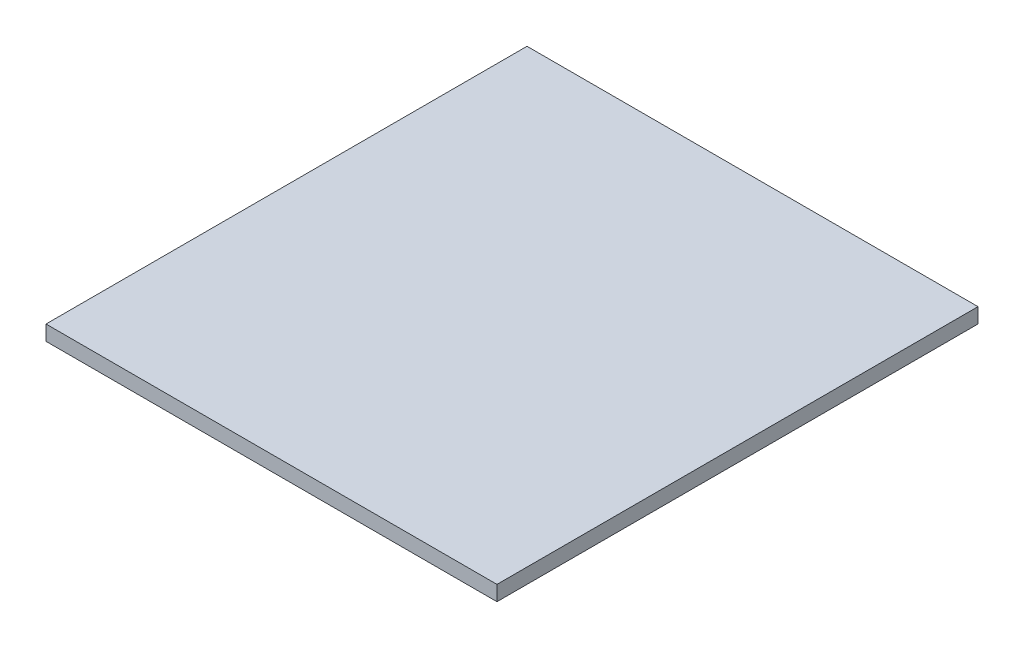
from build123d import *

# Parameters (mm, degrees)
SKETCH1_W           = 571.5
SKETCH1_H           = 609.6
BOSS_EXTRUDE1_DEPTH = 19.05


with BuildPart() as part:
    # Sketch1 → Boss-Extrude1 (new body)
    with BuildSketch(Plane(origin=(0, 0, 0), x_dir=(1, 0, 0), z_dir=(0, 1, 0))):
        with Locations((285.75, 304.8)):
            Rectangle(SKETCH1_W, SKETCH1_H)
    extrude(amount=BOSS_EXTRUDE1_DEPTH)


solid = part.part
